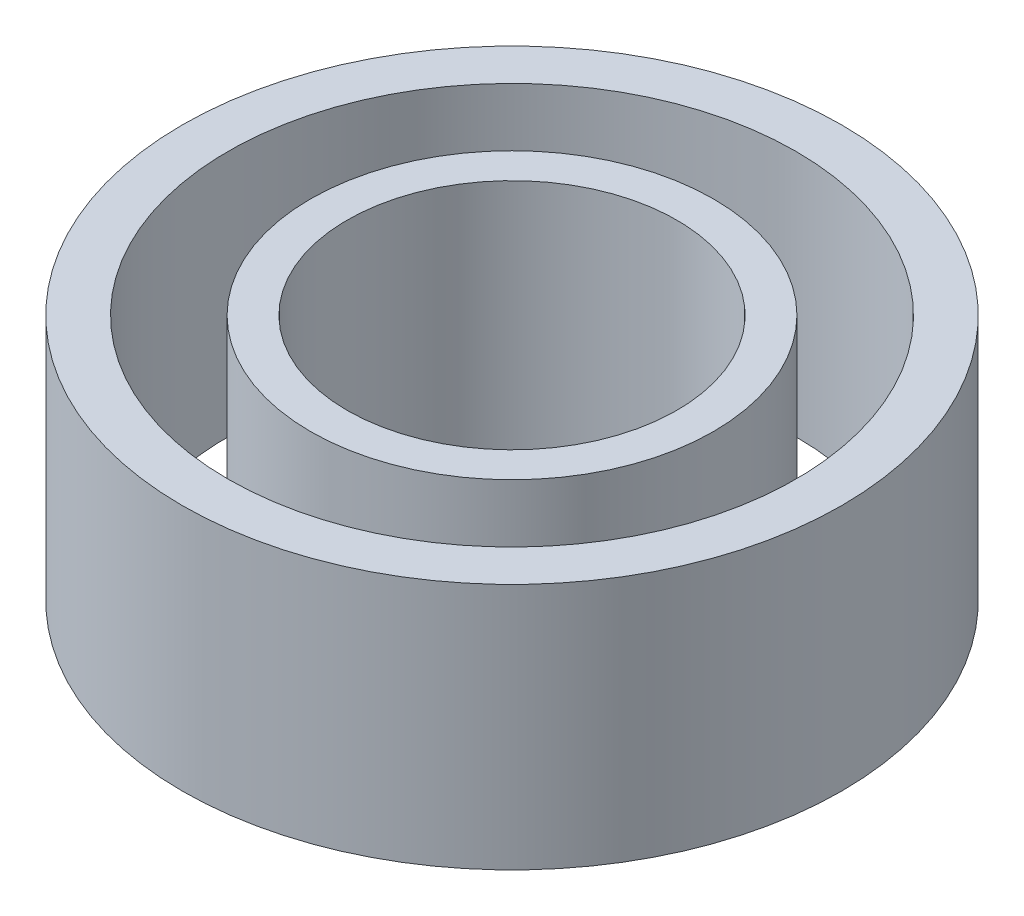
from build123d import *

# Parameters (mm, degrees)
SKETCH1_R           = 4
BOSS_EXTRUDE2_DEPTH = 3
SKETCH3_R           = 2
CUT_EXTRUDE2_DEPTH  = 3
SKETCH4_R           = 3.44443066
SKETCH4_R_2         = 2.44443066
CUT_EXTRUDE3_DEPTH  = 3


with BuildPart() as part:
    # Sketch1 → Boss-Extrude2 (new body)
    with BuildSketch(Plane(origin=(0, 0, 0), x_dir=(1, 0, 0), z_dir=(0, 1, 0))):
        with Locations(Location((0, 0, 0), (0, 0, 270))):
            Circle(SKETCH1_R)
    extrude(amount=BOSS_EXTRUDE2_DEPTH)

    # Sketch3 → Cut-Extrude2 (cut)
    with BuildSketch(Plane(origin=(0, 3, 0), x_dir=(1, 0, 0), z_dir=(0, 1, 0))):
        with Locations(Location((0, 0, 0), (0, 0, 270))):
            Circle(SKETCH3_R)
    extrude(amount=-CUT_EXTRUDE2_DEPTH, mode=Mode.SUBTRACT)

    # Sketch4 → Cut-Extrude3 (cut)
    with BuildSketch(Plane(origin=(0, 3, 0), x_dir=(1, 0, 0), z_dir=(0, 1, 0))):
        with Locations(Location((0, 0, 0), (0, 0, 270))):
            Circle(SKETCH4_R)
        with Locations(Location((0, 0, 0), (0, 0, 270))):
            Circle(SKETCH4_R_2, mode=Mode.SUBTRACT)
    extrude(amount=-CUT_EXTRUDE3_DEPTH, mode=Mode.SUBTRACT)


with BuildPart() as cut_extrude3_piece_1:
    # of the separate pieces the step leaves, piece 1, a body of its own (cut_extrude3_pieces)
    add(part.part.solids().sort_by_distance((0, 0, 4))[0])


with BuildPart() as cut_extrude3_piece_2:
    # of the separate pieces the step leaves, piece 2, a body of its own (cut_extrude3_pieces)
    add(part.part.solids().sort_by_distance((0, 0, 2.44443066))[0])


solid = Compound([cut_extrude3_piece_1.part, cut_extrude3_piece_2.part])
